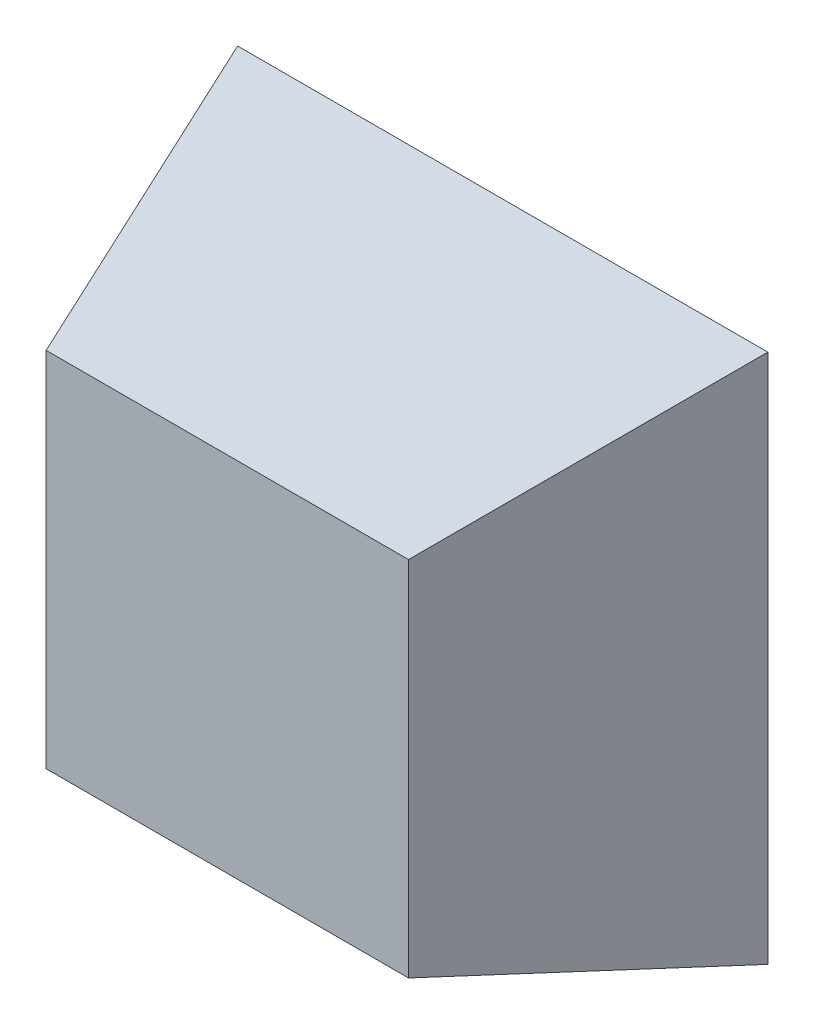
from build123d import *

# Parameters (mm, degrees)
SHELL4_T            = -2.5
SKETCH5_W           = 5.8
SKETCH5_H           = 4
BOSS_EXTRUDE1_DEPTH = 10.9
CUT_EXTRUDE3_DEPTH  = 4
SKETCH7_W           = 12
SKETCH7_H           = 6
CUT_EXTRUDE4_DEPTH  = 0.3


with BuildPart() as part:
    # Sketch1 → Loft2 section 0
    with BuildSketch(Plane.XY):
        with BuildLine():
            Line((-9.05, 9.05), (9.05, 9.05))
            Line((9.05, 9.05), (9.05, -9.05))
            Line((9.05, -9.05), (-9.05, -9.05))
            Line((-9.05, -9.05), (-9.05, 9.05))
        make_face()
    # Sketch2 → Loft2 section 1
    with BuildSketch(Plane.XY.offset(9.4)):
        with BuildLine():
            Line((-6.185, 6.185), (6.185, 6.185))
            Line((6.185, 6.185), (6.185, -6.185))
            Line((6.185, -6.185), (-6.185, -6.185))
            Line((-6.185, -6.185), (-6.185, 6.185))
        make_face()
    loft()

    # Shell4
    shell4_openings = [part.faces().sort_by_distance(p)[0] for p in [
        (0, 0, 0),
    ]]
    offset(amount=SHELL4_T, openings=shell4_openings, kind=Kind.INTERSECTION)

    # Sketch5 → Boss-Extrude1 (add)
    with BuildSketch(Plane.XY.offset(-4)):
        Rectangle(SKETCH5_W, SKETCH5_H)
    extrude(amount=BOSS_EXTRUDE1_DEPTH)

    # Sketch6 → Cut-Extrude3 (cut)
    with BuildSketch(Plane(origin=(0, 0, -4), x_dir=(-1, 0, 0), z_dir=(0, 0, -1))):
        Polygon((0.73, 2.15), (-0.73, 2.15), (-0.73, 0.73), (-2.15, 0.73), (-2.15, -0.73), (-0.73, -0.73), (-0.73, -2.15), (0.73, -2.15), (0.73, -0.73), (2.15, -0.73), (2.15, 0.73), (0.73, 0.73), align=None)
    extrude(amount=-CUT_EXTRUDE3_DEPTH, mode=Mode.SUBTRACT)

    # Sketch7 → Cut-Extrude4 (cut)
    with BuildSketch(Plane(origin=(0, -8.280756947, 2.523869006), x_dir=(1, 0, 0), z_dir=(0, -0.9565567247121477, 0.2915462783298196))):
        with Locations((0, 2.765838851)):
            Rectangle(SKETCH7_W, SKETCH7_H)
    extrude(amount=-CUT_EXTRUDE4_DEPTH, mode=Mode.SUBTRACT)


solid = part.part
